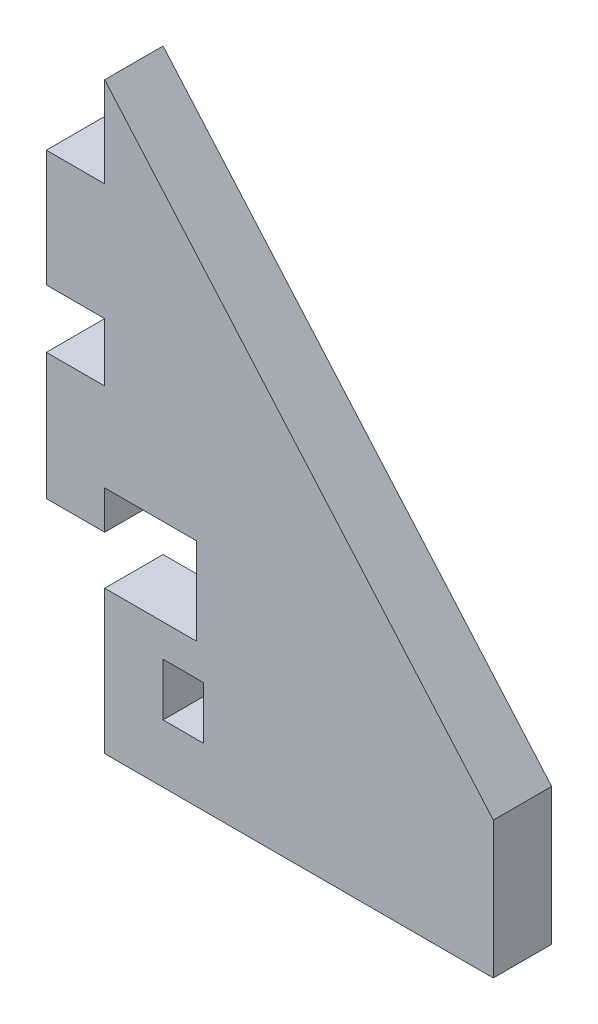
from build123d import *

# Parameters (mm, degrees)
BOSS_EXTRUDE1_DEPTH = 6.35
SKETCH2_W           = 4.4
SKETCH2_H           = 5.72
CUT_EXTRUDE1_DEPTH  = 57.85115788


with BuildPart() as part:
    # Sketch1 → Boss-Extrude1 (new body)
    with BuildSketch(Plane.XY):
        Polygon((-12.346676125, 38.1), (-18.696676125, 38.1), (-18.696676125, 25.4), (-12.346676125, 25.4), (-12.346676125, 19.05), (-18.696676125, 19.05), (-18.696676125, 5.2705), (-12.346676125, 5.2705), (-12.346676125, 9.455763351), (-2.346676125, 9.455763351), (-2.346676125, 5.2705), (-2.346676125, 0), (-12.346676125, 0), (-12.346676125, -15.5875), (29.935330231, -15.5875), (29.935330231, -0.710514446), (-12.346676125, 47.9125), align=None)
    extrude(amount=BOSS_EXTRUDE1_DEPTH)

    # Sketch2 → Cut-Extrude1 (cut, through all)
    with BuildSketch(Plane(origin=(0, 0, 0), x_dir=(-1, 0, 0), z_dir=(0, 0, -1))):
        with Locations((3.796676125, -6.3775)):
            Rectangle(SKETCH2_W, SKETCH2_H)
    extrude(amount=-CUT_EXTRUDE1_DEPTH, mode=Mode.SUBTRACT)


solid = part.part
